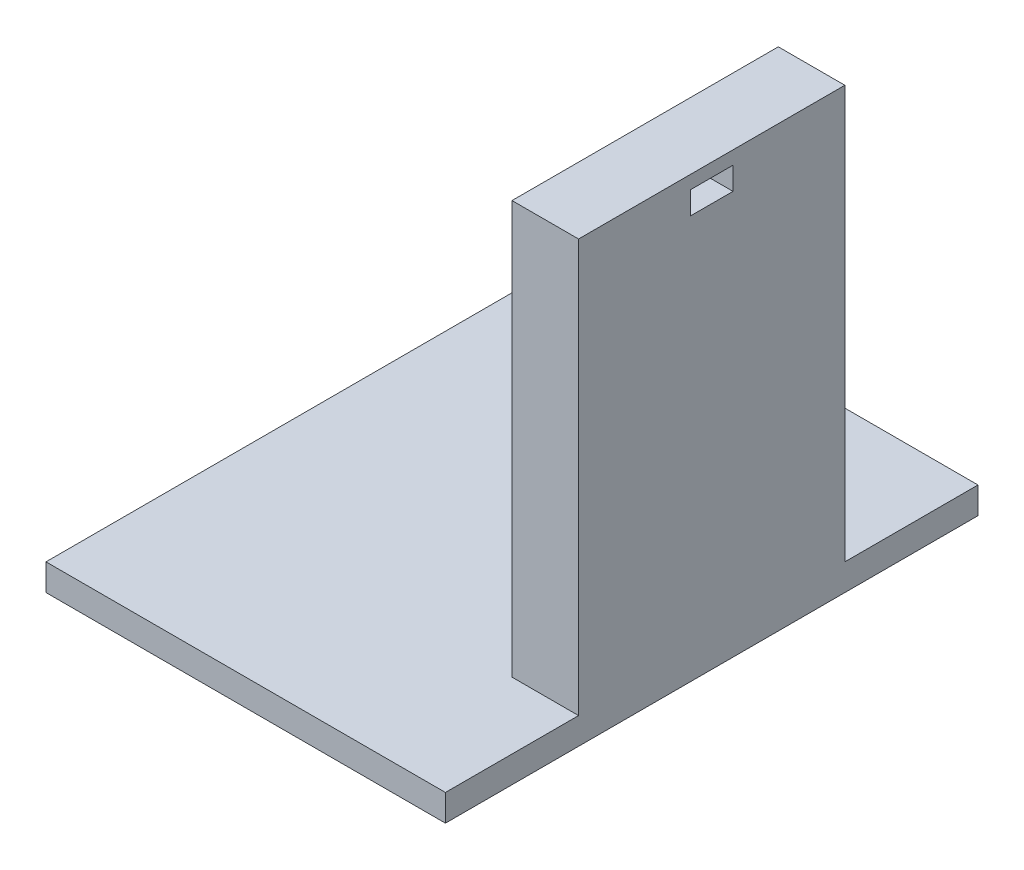
from build123d import *

# Parameters (mm, degrees)
ESQUISSE2_W             = 150
ESQUISSE2_H             = 200
BOSS_EXTRU_6_DEPTH      = 10
ESQUISSE4_W             = 25
ESQUISSE4_H             = 100
BOSS_EXTRU_7_DEPTH      = 160
ESQUISSE8_W             = 24.4
ESQUISSE8_H             = 20.028297961
ENL_V_MAT_EXTRU_1_DEPTH = 12.2
ESQUISSE9_W             = 12
ESQUISSE9_H             = 5
ENL_V_MAT_EXTRU_2_DEPTH = 42.2
ESQUISSE11_W            = 16
ESQUISSE11_H            = 8.51414898
ENL_V_MAT_EXTRU_3_DEPTH = 42.2
ENL_V_MAT_EXTRU_6_DEPTH = 12.2
ESQUISSE13_W            = 25
ESQUISSE13_H            = 100
BOSS_EXTRU_8_DEPTH      = 5
ESQUISSE14_W            = 25.4
ESQUISSE14_H            = 0.5
ENL_V_MAT_EXTRU_7_DEPTH = 12.2
ESQUISSE19_W            = 50
ESQUISSE19_H            = 5
ENL_V_MAT_EXTRU_8_DEPTH = 150
BOSS_EXTRU_9_DEPTH      = 42
BOSS_EXTRU_9_DEPTH_BACK = 75
ESQUISSE21_W            = 50
ESQUISSE21_H            = 5
ESQUISSE22_R            = 5
BOSS_EXTRU_10_DEPTH     = 6


with BuildPart() as part:
    # Esquisse2 → Boss.-Extru.6 (new body)
    with BuildSketch(Plane(origin=(0, 0, 0), x_dir=(1, 0, 0), z_dir=(0, 1, 0))):
        with Locations((-20.308131119, 81.7)):
            Rectangle(ESQUISSE2_W, ESQUISSE2_H)
    extrude(amount=BOSS_EXTRU_6_DEPTH)

    # Esquisse4 → Boss.-Extru.7 (add)
    with BuildSketch(Plane(origin=(0, 0, 0), x_dir=(1, 0, 0), z_dir=(0, 1, 0))):
        with Locations((42.191868881, 81.7)):
            Rectangle(ESQUISSE4_W, ESQUISSE4_H)
    extrude(amount=BOSS_EXTRU_7_DEPTH)

    # Esquisse8 → Enlèv. mat.-Extru.1 (cut)
    with BuildSketch(Plane.ZY.offset(-29.691868881)):
        with Locations((-81.7, 149.985851019)):
            Rectangle(ESQUISSE8_W, ESQUISSE8_H)
    extrude(amount=-ENL_V_MAT_EXTRU_1_DEPTH, mode=Mode.SUBTRACT)

    # Esquisse9 → Enlèv. mat.-Extru.2 (cut)
    with BuildSketch(Plane.ZY.offset(-41.891868881)):
        with Locations((-81.7, 155.98585102)):
            Rectangle(ESQUISSE9_W, ESQUISSE9_H)
    extrude(amount=-ENL_V_MAT_EXTRU_2_DEPTH, mode=Mode.SUBTRACT)

    # Esquisse11 → Enlèv. mat.-Extru.3 (cut)
    with BuildSketch(Plane.ZY.offset(-41.891868881)):
        with Locations((-81.7, 155.74292551)):
            Rectangle(ESQUISSE11_W, ESQUISSE11_H)
    extrude(amount=-ENL_V_MAT_EXTRU_3_DEPTH, mode=Mode.SUBTRACT)

    # Esquisse12 → Enlèv. mat.-Extru.6 (cut)
    with BuildSketch(Plane.ZY.offset(-29.691868881)):
        Polygon((-94.4, 160), (-94.4, 139.97), (-93.9, 139.971702039), (-93.9, 160), align=None)
        Polygon((-69, 139.97), (-69, 160), (-69.5, 160), (-69.5, 139.971702039), align=None)
    extrude(amount=-ENL_V_MAT_EXTRU_6_DEPTH, mode=Mode.SUBTRACT)

    # Esquisse13 → Boss.-Extru.8 (add)
    with BuildSketch(Plane(origin=(0, 160, 0), x_dir=(1, 0, 0), z_dir=(0, 1, 0))):
        with Locations((42.191868881, 81.7)):
            Rectangle(ESQUISSE13_W, ESQUISSE13_H)
    extrude(amount=BOSS_EXTRU_8_DEPTH)

    # Esquisse14 → Enlèv. mat.-Extru.7 (cut)
    with BuildSketch(Plane.ZY.offset(-29.691868881)):
        with Locations((-81.7, 160.25)):
            Rectangle(ESQUISSE14_W, ESQUISSE14_H)
    extrude(amount=-ENL_V_MAT_EXTRU_7_DEPTH, mode=Mode.SUBTRACT)

    # Esquisse19 → Enlèv. mat.-Extru.8 (cut)
    with BuildSketch(Plane.ZY.offset(-41.891868881)):
        with Locations((-81.7, 2.5)):
            Rectangle(ESQUISSE19_W, ESQUISSE19_H)
    extrude(amount=ENL_V_MAT_EXTRU_8_DEPTH, mode=Mode.SUBTRACT)

    # Esquisse21 → Boss.-Extru.9 (add, two sides: drawn at the far end of the back side and taken through both)
    with BuildSketch(Plane(origin=(0, 0, 0), x_dir=(0, 0, -1), z_dir=(1, 0, 0)).offset(-BOSS_EXTRU_9_DEPTH_BACK)):
        with Locations((81.7, 2.5)):
            Rectangle(ESQUISSE21_W, ESQUISSE21_H)
    extrude(amount=BOSS_EXTRU_9_DEPTH + BOSS_EXTRU_9_DEPTH_BACK)

    # Esquisse22 → Boss.-Extru.10 (add)
    with BuildSketch(Plane(origin=(0, 0, 0), x_dir=(1, 0, 0), z_dir=(0, 1, 0))):
        with Locations(Location((-85.154065559, 81.7, 0), (0, 0, 90))):
            Circle(ESQUISSE22_R)
    extrude(amount=BOSS_EXTRU_10_DEPTH)


solid = part.part
